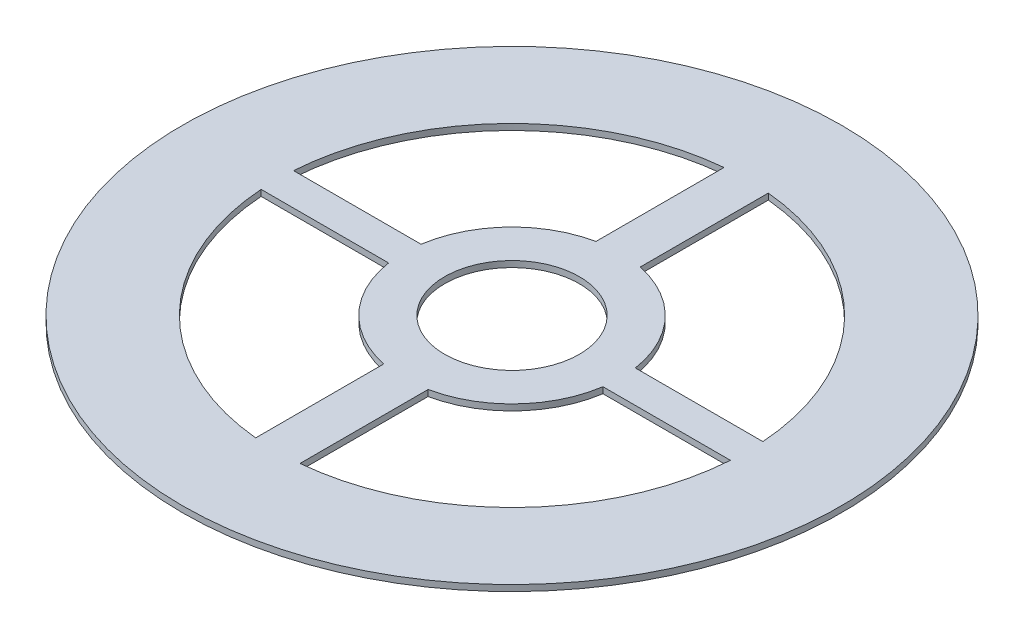
from build123d import *

# Parameters (mm, degrees)
SKETCH1_R           = 161.626262759
SKETCH1_R_2         = 33.019572325
BOSS_EXTRUDE1_DEPTH = 3


with BuildPart() as part:
    # Sketch1 → Boss-Extrude1 (new body)
    with BuildSketch(Plane(origin=(0, 0, 0), x_dir=(1, 0, 0), z_dir=(0, 1, 0))):
        with Locations(Location((0, 0, 0), (0, 0, 270))):
            Circle(SKETCH1_R)
        with Locations(Location((0, 0, 0), (0, 0, 270))):
            Circle(SKETCH1_R_2, mode=Mode.SUBTRACT)
        with BuildLine():
            Line((52.548250078, -7.956005676), (115.082927496, -7.956005676))
            ThreePointArc((115.082927496, -7.956005676), (82.593995543, -80.533285836), (10.860579177, -114.845226489))
            Line((10.860579177, -114.845226489), (10.860579177, -52.025613236))
            ThreePointArc((10.860579177, -52.025613236), (38.609616477, -36.522789161), (52.548250078, -7.956005676))
        make_face(mode=Mode.SUBTRACT)
        with BuildLine():
            Line((52.548250078, 7.956005676), (115.082927496, 7.956005676))
            ThreePointArc((115.082927496, 7.956005676), (82.593995543, 80.533285836), (10.860579177, 114.845226489))
            Line((10.860579177, 114.845226489), (10.860579177, 52.025613236))
            ThreePointArc((10.860579177, 52.025613236), (38.609616477, 36.522789161), (52.548250078, 7.956005676))
        make_face(mode=Mode.SUBTRACT)
        with BuildLine():
            Line((-115.082927496, -7.956005676), (-52.548250078, -7.956005676))
            ThreePointArc((-52.548250078, -7.956005676), (-38.609616477, -36.522789161), (-10.860579177, -52.025613236))
            Line((-10.860579177, -52.025613236), (-10.860579177, -114.845226489))
            ThreePointArc((-10.860579177, -114.845226489), (-82.593995543, -80.533285836), (-115.082927496, -7.956005676))
        make_face(mode=Mode.SUBTRACT)
        with BuildLine():
            Line((-115.082927496, 7.956005676), (-52.548250078, 7.956005676))
            ThreePointArc((-52.548250078, 7.956005676), (-38.609616477, 36.522789161), (-10.860579177, 52.025613236))
            Line((-10.860579177, 52.025613236), (-10.860579177, 114.845226489))
            ThreePointArc((-10.860579177, 114.845226489), (-82.593995543, 80.533285836), (-115.082927496, 7.956005676))
        make_face(mode=Mode.SUBTRACT)
    extrude(amount=BOSS_EXTRUDE1_DEPTH)


solid = part.part
